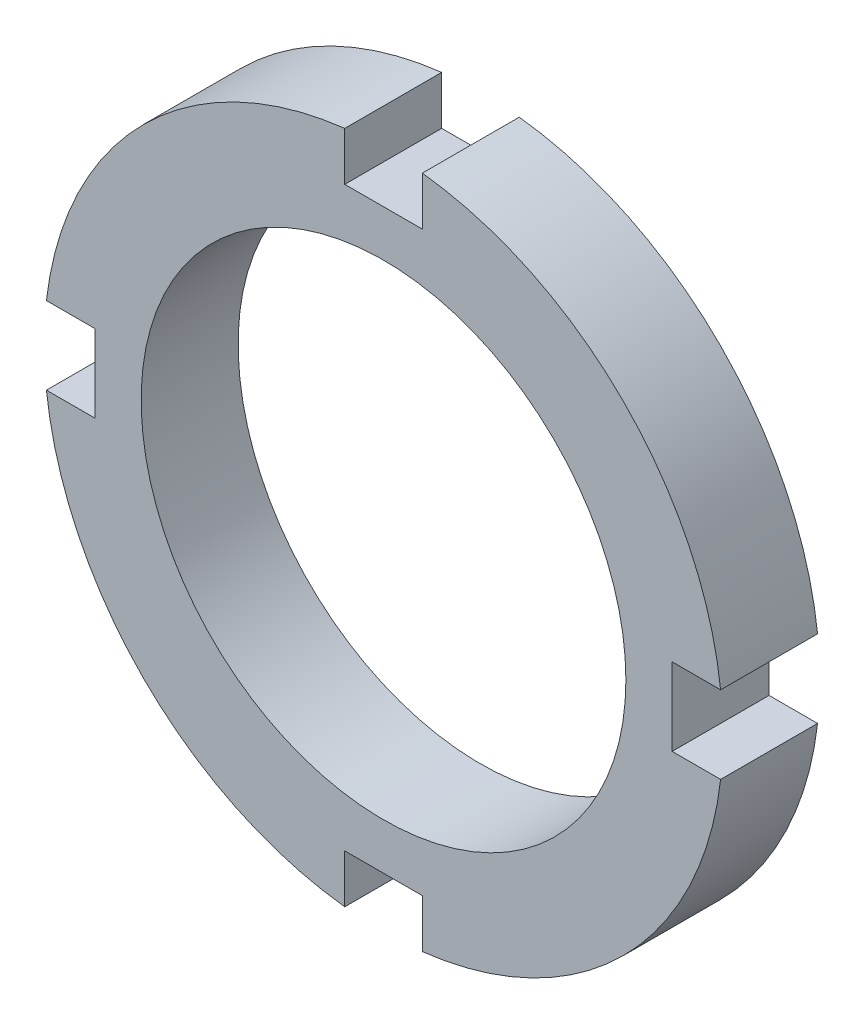
from build123d import *

# Parameters (mm, degrees)
SKETCH1_R           = 12.5
BOSS_EXTRUDE1_DEPTH = 5


with BuildPart() as part:
    # Sketch1 → Boss-Extrude1 (new body)
    with BuildSketch(Plane.XY):
        with BuildLine():
            Line((17.385338651, 2), (14.885338651, 2))
            Line((14.885338651, 2), (14.885338651, -2))
            Line((14.885338651, -2), (17.385338651, -2))
            ThreePointArc((17.385338651, -2), (12.374368671, -12.374368671), (2, -17.385338651))
            Line((2, -17.385338651), (2, -14.885338651))
            Line((2, -14.885338651), (-2, -14.885338651))
            Line((-2, -14.885338651), (-2, -17.385338651))
            ThreePointArc((-2, -17.385338651), (-12.374368671, -12.374368671), (-17.385338651, -2))
            Line((-17.385338651, -2), (-14.885338651, -2))
            Line((-14.885338651, -2), (-14.885338651, 2))
            Line((-14.885338651, 2), (-17.385338651, 2))
            ThreePointArc((-17.385338651, 2), (-12.374368671, 12.374368671), (-2, 17.385338651))
            Line((-2, 17.385338651), (-2, 14.885338651))
            Line((-2, 14.885338651), (2, 14.885338651))
            Line((2, 14.885338651), (2, 17.385338651))
            ThreePointArc((2, 17.385338651), (12.374368671, 12.374368671), (17.385338651, 2))
        make_face()
        Circle(SKETCH1_R, mode=Mode.SUBTRACT)
    extrude(amount=BOSS_EXTRUDE1_DEPTH)


solid = part.part
